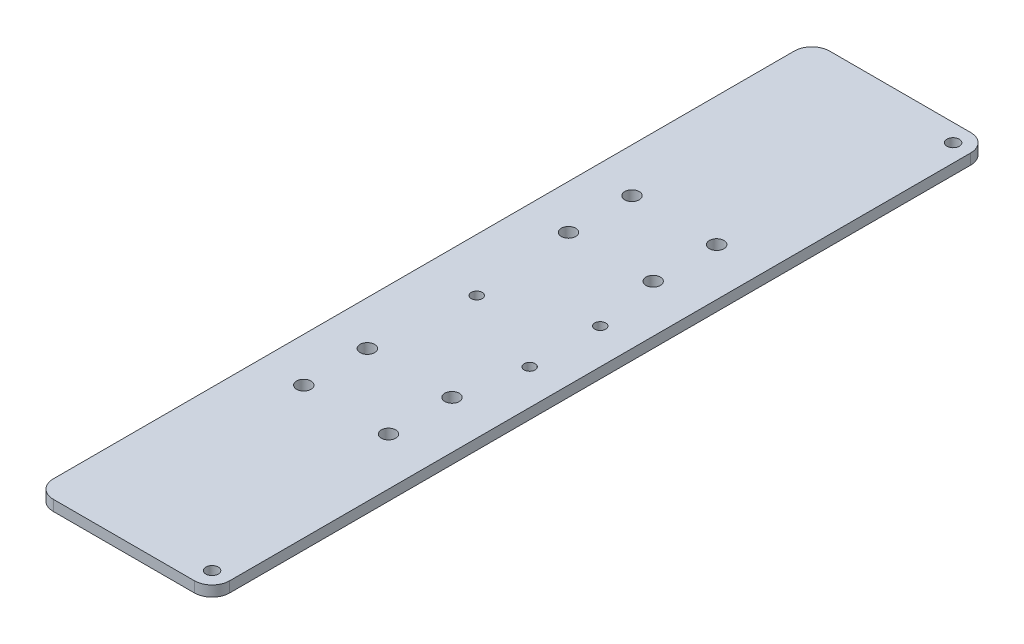
from build123d import *

# Parameters (mm, degrees)
SKETCH1_W       = 50
SKETCH1_H       = 220
EXTRUDE1_DEPTH  = 3
SKETCH2_R       = 1.75
EXTRUDE2_DEPTH  = 3
SKETCH3_R       = 2.05
EXTRUDE3_DEPTH  = 3
SKETCH4_R       = 1.55
EXTRUDE4_DEPTH  = 3
LPATTERN1_COUNT = 2
LPATTERN1_PITCH = 210
LPATTERN2_COUNT = 2
LPATTERN2_PITCH = 75
FILLET1_R       = 5


with BuildPart() as part:
    # Sketch1 → Extrude1 (new body)
    with BuildSketch(Plane(origin=(0, 0, 0), x_dir=(1, 0, 0), z_dir=(0, 1, 0))):
        Rectangle(SKETCH1_W, SKETCH1_H)
    extrude(amount=EXTRUDE1_DEPTH)

    # Sketch2 → Extrude2 (cut)
    with BuildSketch(Plane(origin=(0, 3, 0), x_dir=(1, 0, 0), z_dir=(0, 1, 0))):
        with Locations(Location((20, 105, 0), (0, 0, 270))):
            Circle(SKETCH2_R)
    extrude2 = extrude(amount=-EXTRUDE2_DEPTH, mode=Mode.SUBTRACT)

    # Sketch3 → Extrude3 (cut)
    with BuildSketch(Plane(origin=(0, 3, 0), x_dir=(1, 0, 0), z_dir=(0, 1, 0))):
        with Locations(Location((-12.5, 46.5, 0), (0, 0, 270))):
            Circle(SKETCH3_R)
        with Locations(Location((11.5, 46.5, 0), (0, 0, 270))):
            Circle(SKETCH3_R)
        with Locations(Location((-12.5, 28.5, 0), (0, 0, 270))):
            Circle(SKETCH3_R)
        with Locations(Location((11.5, 28.5, 0), (0, 0, 270))):
            Circle(SKETCH3_R)
    extrude3 = extrude(amount=-EXTRUDE3_DEPTH, mode=Mode.SUBTRACT)

    # Sketch4 → Extrude4 (cut)
    with BuildSketch(Plane(origin=(0, 3, 0), x_dir=(1, 0, 0), z_dir=(0, 1, 0))):
        with Locations(Location((15, 10, 0), (0, 0, 270))):
            Circle(SKETCH4_R)
        with Locations(Location((15, -10, 0), (0, 0, 270))):
            Circle(SKETCH4_R)
        with Locations(Location((-10, 0, 0), (0, 0, 270))):
            Circle(SKETCH4_R)
    extrude(amount=-EXTRUDE4_DEPTH, mode=Mode.SUBTRACT)

    # LPattern1: Extrude2 ×2
    with Locations(*[(0, 0, i * LPATTERN1_PITCH) for i in range(1, LPATTERN1_COUNT)]):
        add(extrude2, mode=Mode.SUBTRACT)

    # LPattern2: Extrude3 ×2
    with Locations(*[(0, 0, i * LPATTERN2_PITCH) for i in range(1, LPATTERN2_COUNT)]):
        add(extrude3, mode=Mode.SUBTRACT)

    # Fillet1
    fillet1_edges = [part.edges().sort_by_distance(p)[0] for p in [
        (-25, 1.5, -110),
        (25, 1.5, -110),
        (25, 1.5, 110),
        (-25, 1.5, 110),
    ]]
    fillet(fillet1_edges, radius=FILLET1_R)


solid = part.part
